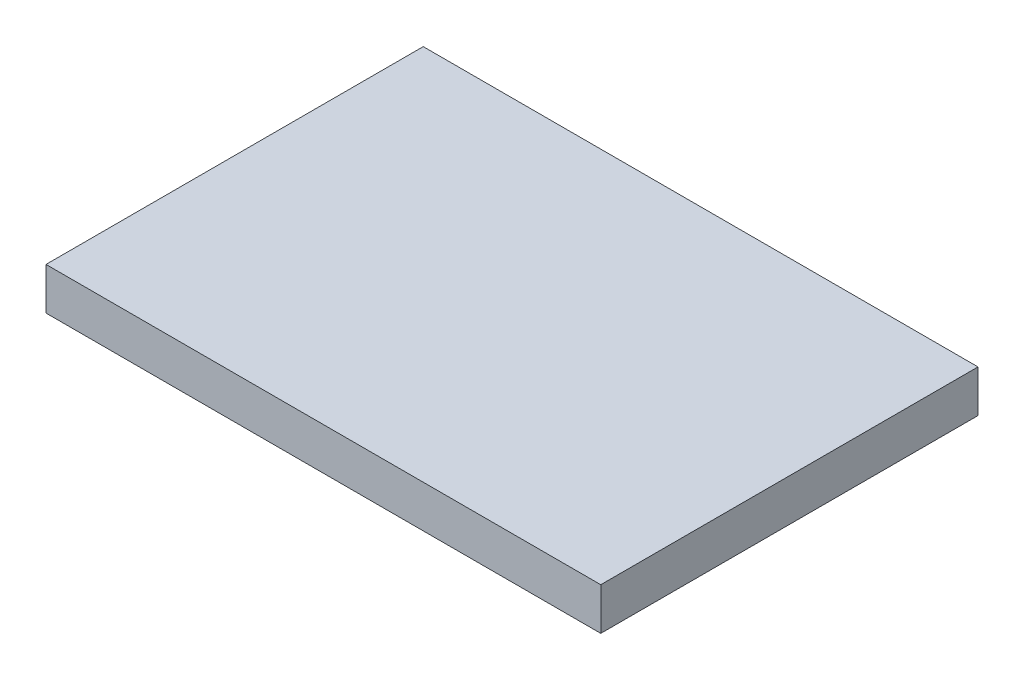
from build123d import *

# Parameters (mm, degrees)
SKETCH1_W           = 50
SKETCH1_H           = 34
BOSS_EXTRUDE1_DEPTH = 3.8


with BuildPart() as part:
    # Sketch1 → Boss-Extrude1 (new body)
    with BuildSketch(Plane(origin=(0, 0, 0), x_dir=(1, 0, 0), z_dir=(0, 1, 0))):
        with Locations((25, 17)):
            Rectangle(SKETCH1_W, SKETCH1_H)
    extrude(amount=BOSS_EXTRUDE1_DEPTH)


solid = part.part
